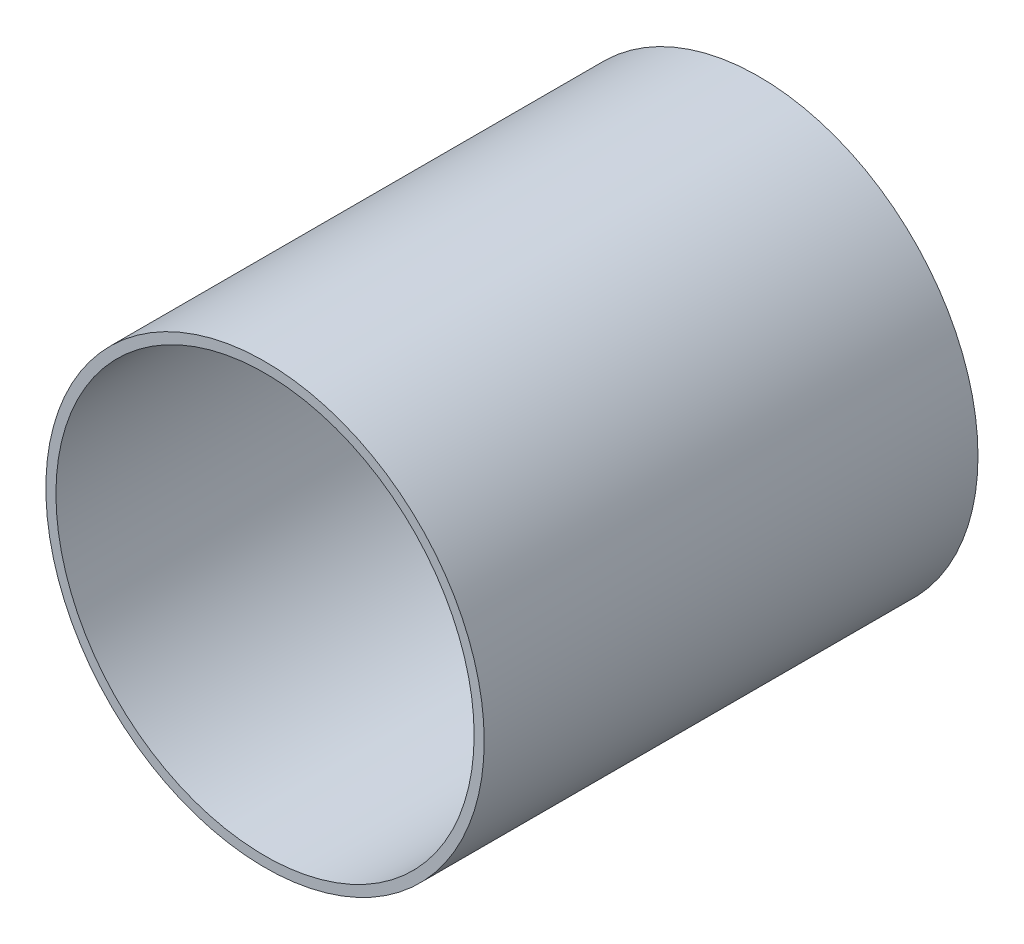
from build123d import *

# Parameters (mm, degrees)
ESQUISSE1_R        = 43.5
ESQUISSE1_R_2      = 41.5
BOSS_EXTRU_1_DEPTH = 98
ESQUISSE2_R        = 41.5
BOSS_EXTRU_2_DEPTH = 9


with BuildPart() as part:
    # Esquisse1 → Boss.-Extru.1 (new body)
    with BuildSketch(Plane.XY):
        Circle(ESQUISSE1_R)
        Circle(ESQUISSE1_R_2, mode=Mode.SUBTRACT)
    extrude(amount=BOSS_EXTRU_1_DEPTH)

    # Esquisse2 → Boss.-Extru.2 (add)
    with BuildSketch(Plane(origin=(0, 0, 0), x_dir=(-1, 0, 0), z_dir=(0, 0, -1))):
        Circle(ESQUISSE2_R)
    extrude(amount=-BOSS_EXTRU_2_DEPTH)


solid = part.part
